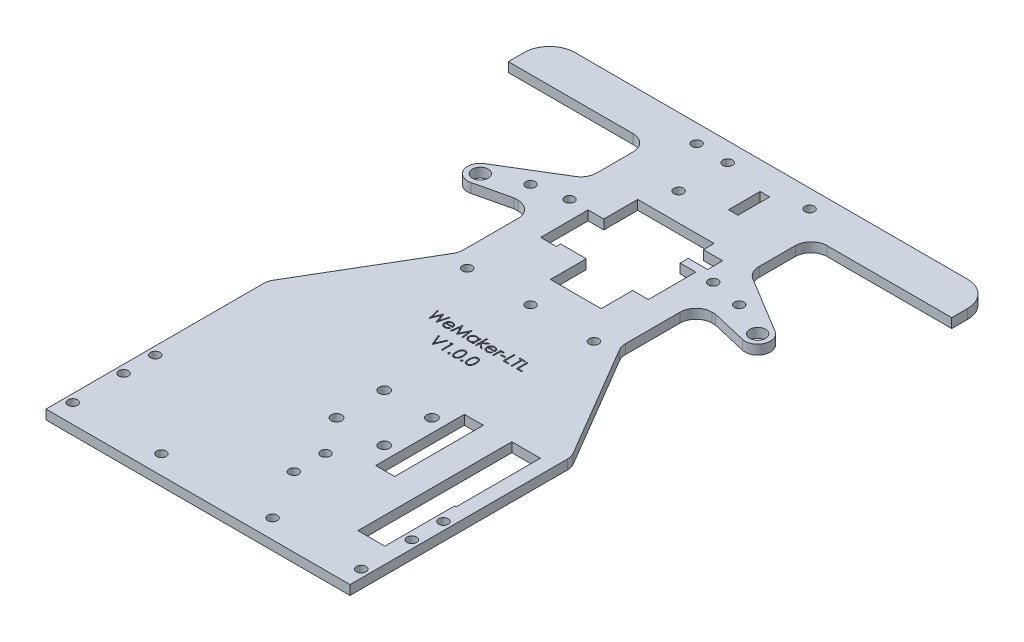
from build123d import *

# Parameters (mm, degrees)
SKETCH1_R           = 1.5
SKETCH1_R_2         = 1.65
SKETCH1_W           = 6
SKETCH1_H           = 28
BOSS_EXTRUDE1_DEPTH = 3
CUT_EXTRUDE2_REACH  = 109.373
SKETCH3_R           = 1.5
CUT_EXTRUDE3_REACH  = 109.373
SKETCH4_W           = 22.395
SKETCH4_H           = 68
SKETCH6_W           = 51.21
SKETCH6_H           = 5
BOSS_EXTRUDE2_DEPTH = 3
CUT_EXTRUDE4_REACH  = 109.373
SKETCH7_R           = 1.5
CUT_EXTRUDE5_REACH  = 109.373
SKETCH9_R           = 1.5
CUT_EXTRUDE6_REACH  = 109.373
SKETCH11_R          = 1.5
SKETCH11_R_2        = 2.5
BOSS_EXTRUDE3_DEPTH = 3
CUT_EXTRUDE7_REACH  = 109.373
CUT_EXTRUDE8_START  = -3
SKETCH13_W          = 4.95
SKETCH13_H          = 15
SKETCH13_W_2        = 6.078763038
SKETCH13_H_2        = 4.767996375
CUT_EXTRUDE8_DEPTH  = 3
BOSS_EXTRUDE4_DEPTH = 3
CUT_EXTRUDE9_REACH  = 120.849
SKETCH15_R          = 1.5
FILLET1_R           = 5
SKETCH16_W          = 1.346153846
SKETCH16_H          = 0.358974359
CUT_EXTRUDE10_DEPTH = 0.5
SKETCH17_R          = 1.5
SKETCH17_W          = 3
SKETCH17_H          = 10
CUT_EXTRUDE11_DEPTH = 119.848643382


with BuildPart() as part:
    # Sketch1 → Boss-Extrude1 (new body)
    with BuildSketch(Plane(origin=(0, 0, 0), x_dir=(1, 0, 0), z_dir=(0, 1, 0))):
        Polygon((-48, -80), (-48, 80), (48, 80), (48, -80), (48, -96), (-48, -96), align=None)
        with Locations(Location((45.5, -74, 0), (0, 0, 270))):
            Circle(SKETCH1_R, mode=Mode.SUBTRACT)
        with Locations(Location((45.5, -64, 0), (0, 0, 270))):
            Circle(SKETCH1_R, mode=Mode.SUBTRACT)
        with Locations(Location((-45.5, -64, 0), (0, 0, 270))):
            Circle(SKETCH1_R, mode=Mode.SUBTRACT)
        with Locations(Location((-45.5, -74, 0), (0, 0, 270))):
            Circle(SKETCH1_R, mode=Mode.SUBTRACT)
        with Locations(Location((8.25, -74, 0), (0, 0, 270))):
            Circle(SKETCH1_R, mode=Mode.SUBTRACT)
        with Locations(Location((8.25, -64, 0), (0, 0, 270))):
            Circle(SKETCH1_R, mode=Mode.SUBTRACT)
        with Locations(Location((0.259511597, -37.46931278, 0), (0, 0, 270))):
            Circle(SKETCH1_R_2, mode=Mode.SUBTRACT)
        with Locations(Location((15.320886036, -37.46931278, 0), (0, 0, 270))):
            Circle(SKETCH1_R_2, mode=Mode.SUBTRACT)
        with Locations(Location((15.320886036, -52.53068722, 0), (0, 0, 270))):
            Circle(SKETCH1_R_2, mode=Mode.SUBTRACT)
        with Locations(Location((0.259511597, -52.53068722, 0), (0, 0, 270))):
            Circle(SKETCH1_R_2, mode=Mode.SUBTRACT)
        with Locations(Location((17.55, -90, 0), (0, 0, 270))):
            Circle(SKETCH1_R, mode=Mode.SUBTRACT)
        with Locations(Location((45.55, -90, 0), (0, 0, 270))):
            Circle(SKETCH1_R, mode=Mode.SUBTRACT)
        with Locations(Location((-45.55, -90, 0), (0, 0, 90))):
            Circle(SKETCH1_R, mode=Mode.SUBTRACT)
        with Locations(Location((-17.55, -90, 0), (0, 0, 90))):
            Circle(SKETCH1_R, mode=Mode.SUBTRACT)
        with Locations((22.5, -45.4)):
            Rectangle(SKETCH1_W, SKETCH1_H, mode=Mode.SUBTRACT)
        Polygon((43, -80), (34.5, -80), (34.5, -31.4), (43, -31.4), (43.5, -31.4), (43.5, -58), (43, -58), align=None, mode=Mode.SUBTRACT)
    extrude(amount=BOSS_EXTRUDE1_DEPTH)

    # Sketch3 → Cut-Extrude2 (cut, up to next)
    with BuildSketch(Plane(origin=(0, 3, 0), x_dir=(1, 0, 0), z_dir=(0, 1, 0)), mode=Mode.PRIVATE) as cut_extrude2_sk1:
        with Locations(Location((0, 9, 0), (0, 0, 270))):
            Circle(SKETCH3_R)
    cut_extrude2_tool1 = extrude(cut_extrude2_sk1.sketch, amount=-CUT_EXTRUDE2_REACH, mode=Mode.PRIVATE) & part.part
    add(cut_extrude2_tool1.solids().sort_by_distance((0, 3, -9))[0], mode=Mode.SUBTRACT)

    # Sketch4 → Cut-Extrude3 (cut, up to next)
    with BuildSketch(Plane(origin=(0, 3, 0), x_dir=(1, 0, 0), z_dir=(0, 1, 0)), mode=Mode.PRIVATE) as cut_extrude3_sk1:
        with Locations((36.8025, 46)):
            Rectangle(SKETCH4_W, SKETCH4_H)
    cut_extrude3_tool1 = extrude(cut_extrude3_sk1.sketch, amount=-CUT_EXTRUDE3_REACH, mode=Mode.PRIVATE) & part.part
    # Sketch4 → Cut-Extrude3 (cut, up to next)
    with BuildSketch(Plane(origin=(0, 3, 0), x_dir=(1, 0, 0), z_dir=(0, 1, 0)), mode=Mode.PRIVATE) as cut_extrude3_sk2:
        with Locations((-36.8025, 46)):
            Rectangle(SKETCH4_W, SKETCH4_H)
    cut_extrude3_tool2 = extrude(cut_extrude3_sk2.sketch, amount=-CUT_EXTRUDE3_REACH, mode=Mode.PRIVATE) & part.part
    add(cut_extrude3_tool1.solids().sort_by_distance((36.8025, 3, -46))[0], mode=Mode.SUBTRACT)
    add(cut_extrude3_tool2.solids().sort_by_distance((-36.8025, 3, -46))[0], mode=Mode.SUBTRACT)

    # Sketch6 → Boss-Extrude2 (add)
    with BuildSketch(Plane(origin=(0, 3, 0), x_dir=(1, 0, 0), z_dir=(0, 1, 0))):
        with Locations((0, 82.5)):
            Rectangle(SKETCH6_W, SKETCH6_H)
    extrude(amount=-BOSS_EXTRUDE2_DEPTH)

    # Sketch7 → Cut-Extrude4 (cut, up to next)
    with BuildSketch(Plane(origin=(0, 3, 0), x_dir=(1, 0, 0), z_dir=(0, 1, 0)), mode=Mode.PRIVATE) as cut_extrude4_sk1:
        with Locations(Location((-17.8495, 79.268380868, 0), (0, 0, 270))):
            Circle(SKETCH7_R)
    cut_extrude4_tool1 = extrude(cut_extrude4_sk1.sketch, amount=-CUT_EXTRUDE4_REACH, mode=Mode.PRIVATE) & part.part
    # Sketch7 → Cut-Extrude4 (cut, up to next)
    with BuildSketch(Plane(origin=(0, 3, 0), x_dir=(1, 0, 0), z_dir=(0, 1, 0)), mode=Mode.PRIVATE) as cut_extrude4_sk2:
        with Locations(Location((17.8495, 79.268380868, 0), (0, 0, 270))):
            Circle(SKETCH7_R)
    cut_extrude4_tool2 = extrude(cut_extrude4_sk2.sketch, amount=-CUT_EXTRUDE4_REACH, mode=Mode.PRIVATE) & part.part
    add(cut_extrude4_tool1.solids().sort_by_distance((-17.8495, 3, -79.268381))[0], mode=Mode.SUBTRACT)
    add(cut_extrude4_tool2.solids().sort_by_distance((17.8495, 3, -79.268381))[0], mode=Mode.SUBTRACT)

    # Sketch9 → Cut-Extrude5 (cut, up to next)
    with BuildSketch(Plane(origin=(0, 3, 0), x_dir=(1, 0, 0), z_dir=(0, 1, 0)), mode=Mode.PRIVATE) as cut_extrude5_sk1:
        with Locations(Location((-22.6907969, 44, 0), (0, 0, 270))):
            Circle(SKETCH9_R)
    cut_extrude5_tool1 = extrude(cut_extrude5_sk1.sketch, amount=-CUT_EXTRUDE5_REACH, mode=Mode.PRIVATE) & part.part
    # Sketch9 → Cut-Extrude5 (cut, up to next)
    with BuildSketch(Plane(origin=(0, 3, 0), x_dir=(1, 0, 0), z_dir=(0, 1, 0)), mode=Mode.PRIVATE) as cut_extrude5_sk2:
        with Locations(Location((22.6907969, 44, 0), (0, 0, 270))):
            Circle(SKETCH9_R)
    cut_extrude5_tool2 = extrude(cut_extrude5_sk2.sketch, amount=-CUT_EXTRUDE5_REACH, mode=Mode.PRIVATE) & part.part
    add(cut_extrude5_tool1.solids().sort_by_distance((-22.690797, 3, -44))[0], mode=Mode.SUBTRACT)
    add(cut_extrude5_tool2.solids().sort_by_distance((22.690797, 3, -44))[0], mode=Mode.SUBTRACT)

    # Sketch10 → Cut-Extrude6 (cut, up to next)
    with BuildSketch(Plane(origin=(0, 3, 0), x_dir=(1, 0, 0), z_dir=(0, 1, 0)), mode=Mode.PRIVATE) as cut_extrude6_sk1:
        Polygon((48, -26), (25.605, 12), (48, 12), align=None)
    cut_extrude6_tool1 = extrude(cut_extrude6_sk1.sketch, amount=-CUT_EXTRUDE6_REACH, mode=Mode.PRIVATE) & part.part
    # Sketch10 → Cut-Extrude6 (cut, up to next)
    with BuildSketch(Plane(origin=(0, 3, 0), x_dir=(1, 0, 0), z_dir=(0, 1, 0)), mode=Mode.PRIVATE) as cut_extrude6_sk2:
        Polygon((-48, -26), (-48, 12), (-25.605, 12), align=None)
    cut_extrude6_tool2 = extrude(cut_extrude6_sk2.sketch, amount=-CUT_EXTRUDE6_REACH, mode=Mode.PRIVATE) & part.part
    add(cut_extrude6_tool1.solids().sort_by_distance((40.535, 3, 0.666667))[0], mode=Mode.SUBTRACT)
    add(cut_extrude6_tool2.solids().sort_by_distance((-40.535, 3, 0.666667))[0], mode=Mode.SUBTRACT)

    # Sketch11 → Boss-Extrude3 (add)
    # profile 1 of 2: a face of its own
    with BuildSketch(Plane.XZ):
        with BuildLine():
            Line((-45.873798612, -40.351535952), (-25.605, -52.641311078))
            Line((-25.605, -52.641311078), (-25.605, -35.641311078))
            Line((-25.605, -35.641311078), (-31.796655586, -35.641311078))
            Line((-31.796655586, -35.641311078), (-42.885371512, -33.037114659))
            ThreePointArc((-42.885371512, -33.037114659), (-47.502761912, -35.418300045), (-45.873798612, -40.351535952))
        make_face()
        with Locations(Location((-32.930328676, -41.931167665, 0), (0, 0, 270))):
            Circle(SKETCH11_R, mode=Mode.SUBTRACT)
        with Locations(Location((-43.799893893, -36.931167665, 0), (0, 0, 270))):
            Circle(SKETCH11_R_2, mode=Mode.SUBTRACT)
    # profile 2 of 2: a face of its own
    with BuildSketch(Plane.XZ):
        with BuildLine():
            Line((25.605, -35.641311078), (25.605, -52.641311078))
            Line((25.605, -52.641311078), (45.873798612, -40.351535952))
            ThreePointArc((45.873798612, -40.351535952), (47.502761912, -35.418300045), (42.885371512, -33.037114659))
            Line((42.885371512, -33.037114659), (31.796655586, -35.641311078))
            Line((31.796655586, -35.641311078), (25.605, -35.641311078))
        make_face()
        with Locations(Location((32.930328676, -41.931167665, 0), (0, 0, 270))):
            Circle(SKETCH11_R, mode=Mode.SUBTRACT)
        with Locations(Location((43.799893893, -36.931167665, 0), (0, 0, 270))):
            Circle(SKETCH11_R_2, mode=Mode.SUBTRACT)
    extrude(amount=-BOSS_EXTRUDE3_DEPTH)

    # Sketch12 → Cut-Extrude7 (cut, up to next)
    with BuildSketch(Plane.XZ, mode=Mode.PRIVATE) as cut_extrude7_sk1:
        Polygon((-11.899893893, -39.441311078), (-11.899893893, -54.741311078), (12.200106107, -54.741311078), (12.200106107, -39.441311078), (17.036431901, -39.441311078), (17.164018107, -32.041311078), (12.200106107, -32.041311078), (12.200106107, -31.191311078), (12.200106107, -25.191311078), (12.200106107, -19.091311078), (-3.799893893, -19.091311078), (-3.799893893, -30.391311078), (-11.899893893, -30.391311078), (-11.899893893, -32.041311078), (-16.849893893, -32.041311078), (-16.849893893, -39.441311078), align=None)
    cut_extrude7_tool1 = extrude(cut_extrude7_sk1.sketch, amount=-CUT_EXTRUDE7_REACH, mode=Mode.PRIVATE) & part.part
    add(cut_extrude7_tool1.solids().sort_by_distance((1.013826, 0, -38.139532))[0], mode=Mode.SUBTRACT)

    # Sketch13 → Cut-Extrude8 (cut)
    with BuildSketch(Plane.XZ.offset(CUT_EXTRUDE8_START)):
        with Locations((-14.374893893, -36.541311078)):
            Rectangle(SKETCH13_W, SKETCH13_H)
        with Locations((14.675106107, -36.541311078)):
            Rectangle(SKETCH13_W, SKETCH13_H)
        with Locations((15.239487626, -48.991959171)):
            Rectangle(SKETCH13_W_2, SKETCH13_H_2)
    extrude(amount=CUT_EXTRUDE8_DEPTH, mode=Mode.SUBTRACT)

    # Sketch14 → Boss-Extrude4 (add)
    with BuildSketch(Plane.XZ):
        with BuildLine():
            Line((-62, -85), (-25.605, -85))
            Line((-25.605, -85), (-25.605, -72))
            Line((-25.605, -72), (-70, -72))
            Line((-70, -72), (-70, -77))
            ThreePointArc((-70, -77), (-67.656854249, -82.656854249), (-62, -85))
        make_face()
        with BuildLine():
            Line((25.605, -72), (25.605, -85))
            Line((25.605, -85), (62, -85))
            ThreePointArc((62, -85), (67.656854249, -82.656854249), (70, -77))
            Line((70, -77), (70, -72))
            Line((70, -72), (25.605, -72))
        make_face()
    extrude(amount=-BOSS_EXTRUDE4_DEPTH)

    # Sketch15 → Cut-Extrude9 (cut, up to next)
    with BuildSketch(Plane(origin=(0, 3, 0), x_dir=(1, 0, 0), z_dir=(0, 1, 0)), mode=Mode.PRIVATE) as cut_extrude9_sk1:
        with Locations(Location((-20, 9, 0), (0, 0, 270))):
            Circle(SKETCH15_R)
    cut_extrude9_tool1 = extrude(cut_extrude9_sk1.sketch, amount=-CUT_EXTRUDE9_REACH, mode=Mode.PRIVATE) & part.part
    # Sketch15 → Cut-Extrude9 (cut, up to next)
    with BuildSketch(Plane(origin=(0, 3, 0), x_dir=(1, 0, 0), z_dir=(0, 1, 0)), mode=Mode.PRIVATE) as cut_extrude9_sk2:
        with Locations(Location((20, 9, 0), (0, 0, 270))):
            Circle(SKETCH15_R)
    cut_extrude9_tool2 = extrude(cut_extrude9_sk2.sketch, amount=-CUT_EXTRUDE9_REACH, mode=Mode.PRIVATE) & part.part
    add(cut_extrude9_tool1.solids().sort_by_distance((-20, 3, -9))[0], mode=Mode.SUBTRACT)
    add(cut_extrude9_tool2.solids().sort_by_distance((20, 3, -9))[0], mode=Mode.SUBTRACT)

    # Fillet1
    fillet1_edges = [part.edges().sort_by_distance(p)[0] for p in [
        (-25.605, 1.5, -12),
        (25.605, 1.5, -12),
        (48, 1.5, 26),
        (-48, 1.5, 26),
        (-25.605, 1.5, -35.641311078),
        (-25.605, 1.5, -52.641311078),
        (25.605, 1.5, -52.641311078),
        (25.605, 1.5, -35.641311078),
        (-25.605, 1.5, -72),
        (25.605, 1.5, -72),
    ]]
    fillet(fillet1_edges, radius=FILLET1_R)

    # Sketch16 → Cut-Extrude10 (cut)
    # profile 1 of 17: a face of its own
    with BuildSketch(Plane(origin=(0, 3, 0), x_dir=(1, 0, 0), z_dir=(0, 1, 0))):
        Polygon((-13.235751468, -7.219057058), (-12.911833199, -7.219057058), (-12.226136084, -9.787967314), (-11.208107237, -7.219057058), (-11.162534321, -7.219057058), (-10.16203352, -9.768335904), (-9.473531917, -7.219057058), (-9.152418135, -7.219057058), (-10.096128071, -10.719057058), (-10.140999866, -10.719057058), (-11.194084802, -8.043576289), (-12.258387686, -10.719057058), (-12.303960603, -10.719057058), align=None)
    # profile 2 of 17: a face of its own
    with BuildSketch(Plane(origin=(0, 3, 0), x_dir=(1, 0, 0), z_dir=(0, 1, 0))):
        with BuildLine():
            Line((-6.514797943, -9.91136475), (-6.235751468, -10.057899206))
            add(Edge.make_bspline(
                [(-6.235751468, -10.057899206), (-6.257988063, -10.097342537), (-6.301251672, -10.17408364), (-6.37565242, -10.2795155), (-6.453644492, -10.374363216), (-6.53874846, -10.45609287), (-6.628418139, -10.527344255), (-6.723150794, -10.58968208), (-6.823439612, -10.6428006), (-6.929289337, -10.687553128), (-7.041588888, -10.721962622), (-7.160610404, -10.746266843), (-7.2865819, -10.761290112), (-7.372928079, -10.763035253), (-7.417141693, -10.763928853)],
                knots=[0, 0, 0, 0, 1.120438281, 2.179929193, 3.190490725, 4.156257408, 5.095198341, 6.022838206, 6.959905092, 7.901321166, 8.864066838, 9.862729781, 10.905609505, 12, 12, 12, 12], degree=3))
            add(Edge.make_bspline(
                [(-7.417141693, -10.763928853), (-7.46628367, -10.762781678), (-7.562145432, -10.760543871), (-7.701685179, -10.741251406), (-7.833064597, -10.709779048), (-7.956276301, -10.665813506), (-8.071018553, -10.608386182), (-8.177519408, -10.5384267), (-8.276338934, -10.456294446), (-8.364363143, -10.361278002), (-8.443607026, -10.259596045), (-8.513532846, -10.15364016), (-8.571990277, -10.043676936), (-8.619542887, -9.930406412), (-8.657947752, -9.814542518), (-8.684714456, -9.695031051), (-8.700144204, -9.572195467), (-8.702508649, -9.489098131), (-8.703700186, -9.447222122)],
                knots=[0, 0, 0, 0, 1.145258523, 2.234067595, 3.276747158, 4.290159414, 5.277019952, 6.260822364, 7.254936242, 8.264827045, 9.274100331, 10.257902744, 11.220704747, 12.172965371, 13.118907548, 14.062713208, 15.023725156, 16, 16, 16, 16], degree=3))
            add(Edge.make_bspline(
                [(-8.703700186, -9.447222122), (-8.702641045, -9.407927292), (-8.700541967, -9.330050127), (-8.687311179, -9.214784583), (-8.663862886, -9.10275613), (-8.631686562, -8.993871682), (-8.590135316, -8.888313548), (-8.539303097, -8.786017484), (-8.479110719, -8.687092345), (-8.432638045, -8.624689211), (-8.409229032, -8.593255776)],
                knots=[0, 0, 0, 0, 1.024358464, 2.0301432, 3.019427413, 4.004406732, 4.986367066, 5.972626655, 6.978780325, 8, 8, 8, 8], degree=3))
            add(Edge.make_bspline(
                [(-8.409229032, -8.593255776), (-8.37752135, -8.555386906), (-8.315110403, -8.480848755), (-8.209554048, -8.38291043), (-8.095253851, -8.300866655), (-7.973642225, -8.232859518), (-7.843305751, -8.181185871), (-7.70599646, -8.142678289), (-7.560150874, -8.121100278), (-7.460445653, -8.118052445), (-7.409429353, -8.116492956)],
                knots=[0, 0, 0, 0, 1.030682036, 2.02871468, 2.997146059, 3.962720338, 4.930598197, 5.918074684, 6.934738563, 8, 8, 8, 8], degree=3))
            add(Edge.make_bspline(
                [(-7.409429353, -8.116492956), (-7.356981748, -8.117847004), (-7.254091502, -8.12050334), (-7.104059381, -8.145129673), (-6.962098664, -8.184182228), (-6.82826616, -8.239336018), (-6.702548299, -8.31049557), (-6.585762249, -8.398637411), (-6.475910737, -8.501055499), (-6.412002158, -8.579818708), (-6.379481436, -8.619898404)],
                knots=[0, 0, 0, 0, 1.056321875, 2.072262726, 3.055038591, 4.01806755, 4.982017516, 5.957941055, 6.960871419, 8, 8, 8, 8], degree=3))
            add(Edge.make_bspline(
                [(-6.379481436, -8.619898404), (-6.357354498, -8.650101986), (-6.313247905, -8.710308104), (-6.258000805, -8.808479261), (-6.21004341, -8.911189856), (-6.171710449, -9.020100153), (-6.140670948, -9.133919733), (-6.118214129, -9.253462278), (-6.10504451, -9.378692189), (-6.102455813, -9.464018745), (-6.101136084, -9.507518597)],
                knots=[0, 0, 0, 0, 0.94817472, 1.890038105, 2.849395472, 3.817997239, 4.812318967, 5.836947057, 6.897266129, 8, 8, 8, 8], degree=3))
            Line((-6.101136084, -9.507518597), (-8.389597622, -9.507518597))
            add(Edge.make_bspline(
                [(-8.389597622, -9.507518597), (-8.388058016, -9.541219061), (-8.385030442, -9.607489665), (-8.370915299, -9.704460448), (-8.348666525, -9.79683379), (-8.317397462, -9.883916832), (-8.279530617, -9.966846959), (-8.2331449, -10.045008996), (-8.177805346, -10.118046926), (-8.116079647, -10.186614064), (-8.047372551, -10.247674825), (-7.975089804, -10.302326601), (-7.898196239, -10.348132198), (-7.817298156, -10.385312088), (-7.732526371, -10.414418404), (-7.643854175, -10.434286225), (-7.551456059, -10.447593331), (-7.488470325, -10.449072997), (-7.456404513, -10.449826289)],
                knots=[0, 0, 0, 0, 1.094153842, 2.151609401, 3.174256925, 4.172055639, 5.149267565, 6.128595816, 7.11444997, 8.118368179, 9.117203808, 10.09244225, 11.054858984, 12.015122123, 12.976791628, 13.957293641, 14.960065497, 16, 16, 16, 16], degree=3))
            add(Edge.make_bspline(
                [(-7.456404513, -10.449826289), (-7.425053366, -10.449218232), (-7.362846675, -10.448011731), (-7.270205817, -10.43627982), (-7.17906629, -10.417309545), (-7.089805307, -10.391419555), (-7.004234461, -10.359842702), (-6.924988911, -10.321739845), (-6.852108695, -10.279590098), (-6.783991728, -10.231380423), (-6.717920735, -10.172372236), (-6.652378249, -10.098736515), (-6.582101595, -10.011648987), (-6.538112003, -9.946103321), (-6.514797943, -9.91136475)],
                knots=[0, 0, 0, 0, 0.99110716, 1.966546729, 2.947904876, 3.932708344, 4.903319531, 5.828989031, 6.710028674, 7.56322171, 8.463672341, 9.504779593, 10.677557249, 12, 12, 12, 12], degree=3))
        make_face()
        with BuildLine():
            add(Edge.make_bspline(
                [(-6.415238648, -9.193416032), (-6.426735272, -9.151753159), (-6.448862574, -9.071565538), (-6.495098938, -8.960524648), (-6.547170479, -8.861836747), (-6.60879221, -8.776257114), (-6.678610936, -8.700253601), (-6.759256119, -8.633835015), (-6.849692012, -8.574417564), (-6.949451153, -8.524265065), (-7.055092938, -8.481575206), (-7.16569913, -8.45295009), (-7.278556918, -8.433340548), (-7.354891204, -8.43151444), (-7.393303552, -8.43059552)],
                knots=[0, 0, 0, 0, 1.154881502, 2.222775134, 3.210006277, 4.132804581, 5.035138423, 5.962687519, 6.919655026, 7.923214229, 8.944639381, 9.960483929, 10.97369054, 12, 12, 12, 12], degree=3))
            add(Edge.make_bspline(
                [(-7.393303552, -8.43059552), (-7.42465299, -8.431207191), (-7.486624239, -8.432416337), (-7.577925307, -8.443886467), (-7.665605006, -8.462846311), (-7.750310294, -8.488811268), (-7.830931162, -8.523419871), (-7.90912593, -8.564003097), (-7.982906327, -8.613544681), (-8.029047622, -8.651303536), (-8.052358039, -8.670379173)],
                knots=[0, 0, 0, 0, 1.04873581, 2.073130211, 3.073294108, 4.04793562, 5.032784715, 6.005352987, 6.992311501, 8, 8, 8, 8], degree=3))
            add(Edge.make_bspline(
                [(-8.052358039, -8.670379173), (-8.069051321, -8.685473489), (-8.102834455, -8.716020705), (-8.147974976, -8.768649912), (-8.191195449, -8.825401474), (-8.230529102, -8.888446598), (-8.266606688, -8.957067377), (-8.300366666, -9.030685013), (-8.330753078, -9.109858143), (-8.347849188, -9.165030582), (-8.356644898, -9.193416032)],
                knots=[0, 0, 0, 0, 0.879870761, 1.780643979, 2.707998968, 3.669668524, 4.684282772, 5.740141944, 6.837334558, 8, 8, 8, 8], degree=3))
            Line((-8.356644898, -9.193416032), (-6.415238648, -9.193416032))
        make_face(mode=Mode.SUBTRACT)
    # profile 3 of 17: a face of its own
    with BuildSketch(Plane(origin=(0, 3, 0), x_dir=(1, 0, 0), z_dir=(0, 1, 0))):
        Polygon((-5.562674545, -10.719057058), (-5.100635282, -7.219057058), (-5.055763487, -7.219057058), (-3.610751468, -10.09085193), (-2.16994618, -7.219057058), (-2.125074385, -7.219057058), (-1.658828391, -10.719057058), (-1.972930955, -10.719057058), (-2.309469417, -8.202730936), (-3.57218977, -10.719057058), (-3.643704193, -10.719057058), (-4.91203352, -8.195018597), (-5.246468616, -10.719057058), align=None)
    # profile 4 of 17: a face of its own
    with BuildSketch(Plane(origin=(0, 3, 0), x_dir=(1, 0, 0), z_dir=(0, 1, 0))):
        with BuildLine():
            Line((1.571940839, -8.16136475), (1.571940839, -10.719057058))
            Line((1.571940839, -10.719057058), (1.257838275, -10.719057058))
            Line((1.257838275, -10.719057058), (1.257838275, -10.276649206))
            add(Edge.make_bspline(
                [(1.257838275, -10.276649206), (1.222419485, -10.316688799), (1.153299269, -10.394826571), (1.037858151, -10.496908743), (0.915489974, -10.581287065), (0.786788652, -10.64943698), (0.651870409, -10.700629037), (0.511034322, -10.737015196), (0.364222941, -10.760409031), (0.263970586, -10.762745053), (0.213166801, -10.763928853)],
                knots=[0, 0, 0, 0, 1.074387032, 2.096679803, 3.090159297, 4.057316773, 5.018401886, 5.985159533, 6.978961417, 8, 8, 8, 8], degree=3))
            add(Edge.make_bspline(
                [(0.213166801, -10.763928853), (0.167998847, -10.762702481), (0.078925642, -10.76028402), (-0.052103435, -10.741521717), (-0.178195684, -10.711391095), (-0.299470257, -10.669490206), (-0.415142402, -10.613909384), (-0.526202499, -10.547368136), (-0.632075191, -10.468127306), (-0.73114673, -10.377539277), (-0.82237873, -10.27914429), (-0.902440003, -10.174198743), (-0.969193083, -10.063156439), (-1.025013164, -9.947423286), (-1.068009508, -9.826108366), (-1.097983142, -9.699631198), (-1.116723589, -9.568141325), (-1.11914105, -9.478601801), (-1.120366853, -9.433199686)],
                knots=[0, 0, 0, 0, 1.033919861, 2.038935746, 3.024066025, 3.998881131, 4.97069526, 5.957263378, 6.95902576, 7.993208707, 9.027059324, 10.027763471, 11.009749337, 11.988697705, 12.965288445, 13.950418724, 14.960734635, 16, 16, 16, 16], degree=3))
            add(Edge.make_bspline(
                [(-1.120366853, -9.433199686), (-1.119113881, -9.388735983), (-1.116636825, -9.300833639), (-1.098183605, -9.171554941), (-1.067152596, -9.047036681), (-1.023604748, -8.927679737), (-0.967762794, -8.813339687), (-0.899834706, -8.703935662), (-0.819815582, -8.599166265), (-0.727563175, -8.501495038), (-0.627628405, -8.411274424), (-0.520719674, -8.332865378), (-0.409496392, -8.265148529), (-0.292233382, -8.211495053), (-0.170666277, -8.168085949), (-0.043712831, -8.138052981), (0.088098747, -8.120355659), (0.177589239, -8.117792895), (0.222982506, -8.116492956)],
                knots=[0, 0, 0, 0, 1.020392517, 2.01726096, 2.990465484, 3.961182959, 4.928053699, 5.906110375, 6.912531644, 7.948652711, 8.985773172, 9.998621852, 10.987621588, 11.969261332, 12.953316658, 13.946091881, 14.958173133, 16, 16, 16, 16], degree=3))
            add(Edge.make_bspline(
                [(0.222982506, -8.116492956), (0.275182365, -8.117930707), (0.377543825, -8.12075007), (0.527271834, -8.144212797), (0.668916312, -8.183851264), (0.803570664, -8.237768762), (0.93075135, -8.309417492), (1.049254335, -8.399797453), (1.160319818, -8.50833864), (1.22470011, -8.591709084), (1.257838275, -8.634621962)],
                knots=[0, 0, 0, 0, 1.038897134, 2.037228247, 3.008116434, 3.962042015, 4.918381754, 5.904844433, 6.921570401, 8, 8, 8, 8], degree=3))
            Line((1.257838275, -8.634621962), (1.257838275, -8.16136475))
            Line((1.257838275, -8.16136475), (1.571940839, -8.16136475))
        make_face()
        with BuildLine():
            add(Edge.make_bspline(
                [(0.227189237, -8.43059552), (0.181274899, -8.432229157), (0.090647299, -8.435453698), (-0.042396703, -8.460627194), (-0.169710117, -8.502511788), (-0.290656191, -8.559793689), (-0.403324408, -8.631822426), (-0.504018079, -8.718943809), (-0.59356078, -8.818780823), (-0.668869044, -8.930882934), (-0.730259541, -9.051061025), (-0.773426573, -9.176685463), (-0.801895821, -9.30549044), (-0.804804341, -9.392853126), (-0.806264289, -9.436705295)],
                knots=[0, 0, 0, 0, 1.031046209, 2.035121221, 3.029706178, 4.034933723, 5.034054252, 6.02443088, 7.017295772, 8.038157696, 9.050218397, 10.03989886, 11.016116709, 12, 12, 12, 12], degree=3))
            add(Edge.make_bspline(
                [(-0.806264289, -9.436705295), (-0.804399395, -9.480295402), (-0.800676919, -9.567304758), (-0.773926224, -9.696285335), (-0.729046351, -9.821939377), (-0.667804288, -9.943200371), (-0.591117663, -10.055784471), (-0.502229011, -10.157524594), (-0.400278729, -10.245014182), (-0.287351222, -10.318251755), (-0.166743252, -10.377414276), (-0.03990932, -10.418579916), (0.090766318, -10.445157696), (0.179618652, -10.448262173), (0.22438475, -10.449826289)],
                knots=[0, 0, 0, 0, 0.979072187, 1.954306742, 2.945804271, 3.96968567, 4.997920485, 5.998718438, 6.996577872, 8.005894225, 9.015743152, 10.005417472, 10.995077863, 12, 12, 12, 12], degree=3))
            add(Edge.make_bspline(
                [(0.22438475, -10.449826289), (0.269831252, -10.448166325), (0.360219839, -10.444864821), (0.493658547, -10.419583556), (0.62315351, -10.377814758), (0.746940738, -10.319915631), (0.862256869, -10.248158275), (0.965754747, -10.164151184), (1.053270715, -10.066448), (1.127463325, -9.959071547), (1.185638741, -9.84135955), (1.228014801, -9.71602536), (1.253068706, -9.583064611), (1.256226436, -9.492200685), (1.257838275, -9.445819879)],
                knots=[0, 0, 0, 0, 1.01762866, 2.023962475, 3.030623092, 4.058876274, 5.077231937, 6.066672613, 7.034107872, 8.005628644, 8.981990164, 9.965428785, 10.961468474, 12, 12, 12, 12], degree=3))
            add(Edge.make_bspline(
                [(1.257838275, -9.445819879), (1.256878619, -9.410482048), (1.254989712, -9.340926015), (1.240559142, -9.238798497), (1.217604216, -9.141064771), (1.185258046, -9.047622082), (1.142766761, -8.958987067), (1.091518995, -8.874523306), (1.030613546, -8.794670095), (0.961030849, -8.720527024), (0.884865647, -8.652900562), (0.804271106, -8.592536321), (0.718292359, -8.542947548), (0.628375322, -8.501906277), (0.534363988, -8.469247127), (0.435493368, -8.447459433), (0.332814381, -8.432499112), (0.262768326, -8.431236731), (0.227189237, -8.43059552)],
                knots=[0, 0, 0, 0, 1.050140795, 2.067009409, 3.05949893, 4.030605086, 5.00011959, 5.97591094, 6.962425594, 7.979863591, 8.993523472, 9.986985069, 10.967611495, 11.937549037, 12.921786183, 13.919465291, 14.943216303, 16, 16, 16, 16], degree=3))
        make_face(mode=Mode.SUBTRACT)
    # profile 5 of 17: a face of its own
    with BuildSketch(Plane(origin=(0, 3, 0), x_dir=(1, 0, 0), z_dir=(0, 1, 0))):
        Polygon((2.289889557, -7.129313468), (2.603992122, -7.129313468), (2.603992122, -9.204633981), (3.768555423, -8.16136475), (4.219376737, -8.16136475), (2.86901616, -9.372903212), (4.353992122, -10.719057058), (3.903170807, -10.719057058), (2.603992122, -9.540471321), (2.603992122, -10.719057058), (2.289889557, -10.719057058), align=None)
    # profile 6 of 17: a face of its own
    with BuildSketch(Plane(origin=(0, 3, 0), x_dir=(1, 0, 0), z_dir=(0, 1, 0))):
        with BuildLine():
            Line((6.812125134, -9.91136475), (7.091171609, -10.057899206))
            add(Edge.make_bspline(
                [(7.091171609, -10.057899206), (7.068935013, -10.097342537), (7.025671405, -10.17408364), (6.951270657, -10.2795155), (6.873278584, -10.374363216), (6.788174616, -10.45609287), (6.698504938, -10.527344255), (6.603772283, -10.58968208), (6.503483465, -10.6428006), (6.39763374, -10.687553128), (6.285334189, -10.721962622), (6.166312673, -10.746266843), (6.040341177, -10.761290112), (5.953994997, -10.763035253), (5.909781384, -10.763928853)],
                knots=[0, 0, 0, 0, 1.120438281, 2.179929193, 3.190490725, 4.156257408, 5.095198341, 6.022838206, 6.959905092, 7.901321166, 8.864066838, 9.862729781, 10.905609505, 12, 12, 12, 12], degree=3))
            add(Edge.make_bspline(
                [(5.909781384, -10.763928853), (5.860639407, -10.762781678), (5.764777645, -10.760543871), (5.625237898, -10.741251406), (5.49385848, -10.709779048), (5.370646776, -10.665813506), (5.255904524, -10.608386182), (5.149403669, -10.5384267), (5.050584143, -10.456294446), (4.962559934, -10.361278002), (4.883316051, -10.259596045), (4.813390231, -10.15364016), (4.7549328, -10.043676936), (4.70738019, -9.930406412), (4.668975325, -9.814542518), (4.642208621, -9.695031051), (4.626778873, -9.572195467), (4.624414428, -9.489098131), (4.623222891, -9.447222122)],
                knots=[0, 0, 0, 0, 1.145258523, 2.234067595, 3.276747158, 4.290159414, 5.277019952, 6.260822364, 7.254936242, 8.264827045, 9.274100331, 10.257902744, 11.220704747, 12.172965371, 13.118907548, 14.062713208, 15.023725156, 16, 16, 16, 16], degree=3))
            add(Edge.make_bspline(
                [(4.623222891, -9.447222122), (4.624282032, -9.407927292), (4.62638111, -9.330050127), (4.639611898, -9.214784583), (4.663060191, -9.10275613), (4.695236515, -8.993871682), (4.736787761, -8.888313548), (4.78761998, -8.786017484), (4.847812358, -8.687092345), (4.894285032, -8.624689211), (4.917694045, -8.593255776)],
                knots=[0, 0, 0, 0, 1.024358464, 2.0301432, 3.019427413, 4.004406732, 4.986367066, 5.972626655, 6.978780325, 8, 8, 8, 8], degree=3))
            add(Edge.make_bspline(
                [(4.917694045, -8.593255776), (4.949401727, -8.555386906), (5.011812674, -8.480848755), (5.117369029, -8.38291043), (5.231669226, -8.300866655), (5.353280852, -8.232859518), (5.483617326, -8.181185871), (5.620926617, -8.142678289), (5.766772203, -8.121100278), (5.866477424, -8.118052445), (5.917493724, -8.116492956)],
                knots=[0, 0, 0, 0, 1.030682036, 2.02871468, 2.997146059, 3.962720338, 4.930598197, 5.918074684, 6.934738563, 8, 8, 8, 8], degree=3))
            add(Edge.make_bspline(
                [(5.917493724, -8.116492956), (5.969941329, -8.117847004), (6.072831575, -8.12050334), (6.222863696, -8.145129673), (6.364824413, -8.184182228), (6.498656917, -8.239336018), (6.624374778, -8.31049557), (6.741160828, -8.398637411), (6.85101234, -8.501055499), (6.914920919, -8.579818708), (6.947441641, -8.619898404)],
                knots=[0, 0, 0, 0, 1.056321875, 2.072262726, 3.055038591, 4.01806755, 4.982017516, 5.957941055, 6.960871419, 8, 8, 8, 8], degree=3))
            add(Edge.make_bspline(
                [(6.947441641, -8.619898404), (6.969568579, -8.650101986), (7.013675172, -8.710308104), (7.068922272, -8.808479261), (7.116879667, -8.911189856), (7.155212628, -9.020100153), (7.186252129, -9.133919733), (7.208708948, -9.253462278), (7.221878567, -9.378692189), (7.224467264, -9.464018745), (7.225786993, -9.507518597)],
                knots=[0, 0, 0, 0, 0.94817472, 1.890038105, 2.849395472, 3.817997239, 4.812318967, 5.836947057, 6.897266129, 8, 8, 8, 8], degree=3))
            Line((7.225786993, -9.507518597), (4.937325455, -9.507518597))
            add(Edge.make_bspline(
                [(4.937325455, -9.507518597), (4.938865061, -9.541219061), (4.941892635, -9.607489665), (4.956007778, -9.704460448), (4.978256552, -9.79683379), (5.009525615, -9.883916832), (5.04739246, -9.966846959), (5.093778177, -10.045008996), (5.149117731, -10.118046926), (5.21084343, -10.186614064), (5.279550526, -10.247674825), (5.351833273, -10.302326601), (5.428726838, -10.348132198), (5.509624921, -10.385312088), (5.594396706, -10.414418404), (5.683068901, -10.434286225), (5.775467018, -10.447593331), (5.838452752, -10.449072997), (5.870518564, -10.449826289)],
                knots=[0, 0, 0, 0, 1.094153842, 2.151609401, 3.174256925, 4.172055639, 5.149267565, 6.128595816, 7.11444997, 8.118368179, 9.117203808, 10.09244225, 11.054858984, 12.015122123, 12.976791628, 13.957293641, 14.960065497, 16, 16, 16, 16], degree=3))
            add(Edge.make_bspline(
                [(5.870518564, -10.449826289), (5.901869711, -10.449218232), (5.964076402, -10.448011731), (6.05671726, -10.43627982), (6.147856787, -10.417309545), (6.23711777, -10.391419555), (6.322688616, -10.359842702), (6.401934166, -10.321739845), (6.474814382, -10.279590098), (6.542931349, -10.231380423), (6.609002342, -10.172372236), (6.674544828, -10.098736515), (6.744821482, -10.011648987), (6.788811074, -9.946103321), (6.812125134, -9.91136475)],
                knots=[0, 0, 0, 0, 0.99110716, 1.966546729, 2.947904876, 3.932708344, 4.903319531, 5.828989031, 6.710028674, 7.56322171, 8.463672341, 9.504779593, 10.677557249, 12, 12, 12, 12], degree=3))
        make_face()
        with BuildLine():
            add(Edge.make_bspline(
                [(6.911684429, -9.193416032), (6.900187805, -9.151753159), (6.878060503, -9.071565538), (6.831824139, -8.960524648), (6.779752598, -8.861836747), (6.718130867, -8.776257114), (6.648312141, -8.700253601), (6.567666958, -8.633835015), (6.477231065, -8.574417564), (6.377471924, -8.524265065), (6.271830139, -8.481575206), (6.161223947, -8.45295009), (6.048366159, -8.433340548), (5.972031873, -8.43151444), (5.933619525, -8.43059552)],
                knots=[0, 0, 0, 0, 1.154881502, 2.222775134, 3.210006277, 4.132804581, 5.035138423, 5.962687519, 6.919655026, 7.923214229, 8.944639381, 9.960483929, 10.97369054, 12, 12, 12, 12], degree=3))
            add(Edge.make_bspline(
                [(5.933619525, -8.43059552), (5.902270087, -8.431207191), (5.840298838, -8.432416337), (5.74899777, -8.443886467), (5.661318071, -8.462846311), (5.576612783, -8.488811268), (5.495991915, -8.523419871), (5.417797146, -8.564003097), (5.34401675, -8.613544681), (5.297875455, -8.651303536), (5.274565038, -8.670379173)],
                knots=[0, 0, 0, 0, 1.04873581, 2.073130211, 3.073294108, 4.04793562, 5.032784715, 6.005352987, 6.992311501, 8, 8, 8, 8], degree=3))
            add(Edge.make_bspline(
                [(5.274565038, -8.670379173), (5.257871756, -8.685473489), (5.224088622, -8.716020705), (5.1789481, -8.768649912), (5.135727628, -8.825401474), (5.096393975, -8.888446598), (5.060316389, -8.957067377), (5.026556411, -9.030685013), (4.996169999, -9.109858143), (4.979073889, -9.165030582), (4.970278179, -9.193416032)],
                knots=[0, 0, 0, 0, 0.879870761, 1.780643979, 2.707998968, 3.669668524, 4.684282772, 5.740141944, 6.837334558, 8, 8, 8, 8], degree=3))
            Line((4.970278179, -9.193416032), (6.911684429, -9.193416032))
        make_face(mode=Mode.SUBTRACT)
    # profile 7 of 17: a face of its own
    with BuildSketch(Plane(origin=(0, 3, 0), x_dir=(1, 0, 0), z_dir=(0, 1, 0))):
        with BuildLine():
            Line((7.764248532, -8.16136475), (8.078351096, -8.16136475))
            Line((8.078351096, -8.16136475), (8.078351096, -8.537867154))
            add(Edge.make_bspline(
                [(8.078351096, -8.537867154), (8.101539855, -8.502811326), (8.145888176, -8.435767327), (8.219601105, -8.347098026), (8.295104436, -8.273682979), (8.372759623, -8.21517946), (8.453137723, -8.171366341), (8.534474675, -8.139273306), (8.618050145, -8.120295991), (8.674212069, -8.117762332), (8.702349493, -8.116492956)],
                knots=[0, 0, 0, 0, 1.2804753, 2.448899062, 3.506932113, 4.484331642, 5.4025378, 6.288909075, 7.142734305, 8, 8, 8, 8], degree=3))
            add(Edge.make_bspline(
                [(8.702349493, -8.116492956), (8.72417582, -8.117683482), (8.769084905, -8.120133068), (8.837067495, -8.137343893), (8.907110947, -8.164821915), (8.952253334, -8.190662138), (8.975786993, -8.20413318)],
                knots=[0, 0, 0, 0, 0.901110191, 1.854092781, 2.881294221, 4, 4, 4, 4], degree=3))
            Line((8.975786993, -8.20413318), (8.803311032, -8.476168436))
            add(Edge.make_bspline(
                [(8.803311032, -8.476168436), (8.788202011, -8.46942817), (8.759522196, -8.456633855), (8.71756763, -8.441491845), (8.678886293, -8.432575929), (8.654242735, -8.431225211), (8.642754141, -8.43059552)],
                knots=[0, 0, 0, 0, 1.180555205, 2.24091978, 3.179933427, 4, 4, 4, 4], degree=3))
            add(Edge.make_bspline(
                [(8.642754141, -8.43059552), (8.617548407, -8.432275557), (8.566136017, -8.435702346), (8.490651518, -8.462641154), (8.417404312, -8.506166394), (8.35923265, -8.554437506), (8.314190397, -8.600985303), (8.282050172, -8.641633706), (8.252567425, -8.687212338), (8.224397204, -8.736942021), (8.19873091, -8.791671867), (8.174776241, -8.850855081), (8.153117378, -8.91456021), (8.140767134, -8.95894273), (8.134440839, -8.98167725)],
                knots=[0, 0, 0, 0, 1.125678352, 2.296057538, 3.5422874, 4.923748041, 5.663163013, 6.437101912, 7.23742474, 8.08941207, 8.991984279, 9.93940061, 10.944477711, 12, 12, 12, 12], degree=3))
            add(Edge.make_bspline(
                [(8.134440839, -8.98167725), (8.129708446, -9.001954424), (8.119226554, -9.046866823), (8.109035017, -9.122215347), (8.098965499, -9.211239006), (8.09186888, -9.314185599), (8.085290838, -9.430798043), (8.081580756, -9.561253989), (8.078477615, -9.70568734), (8.078394548, -9.806661693), (8.078351096, -9.859481738)],
                knots=[0, 0, 0, 0, 0.566838948, 1.255505196, 2.06880316, 3.007127437, 4.065329342, 5.249902469, 6.561414163, 8, 8, 8, 8], degree=3))
            Line((8.078351096, -9.859481738), (8.078351096, -10.719057058))
            Line((8.078351096, -10.719057058), (7.764248532, -10.719057058))
            Line((7.764248532, -10.719057058), (7.764248532, -8.16136475))
        make_face()
    # profile 8 of 17: a face of its own
    with BuildSketch(Plane(origin=(0, 3, 0), x_dir=(1, 0, 0), z_dir=(0, 1, 0))):
        with Locations((9.738607506, -9.372903212)):
            Rectangle(SKETCH16_W, SKETCH16_H)
    # profile 9 of 17: a face of its own
    with BuildSketch(Plane(origin=(0, 3, 0), x_dir=(1, 0, 0), z_dir=(0, 1, 0))):
        Polygon((10.995017763, -7.219057058), (11.309120327, -7.219057058), (11.309120327, -10.360082699), (12.655274173, -10.360082699), (12.655274173, -10.719057058), (10.995017763, -10.719057058), align=None)
    # profile 10 of 17: a face of its own
    with BuildSketch(Plane(origin=(0, 3, 0), x_dir=(1, 0, 0), z_dir=(0, 1, 0))):
        Polygon((12.834761352, -7.578031417), (12.834761352, -7.219057058), (14.674504942, -7.219057058), (14.674504942, -7.578031417), (13.911684429, -7.578031417), (13.911684429, -10.719057058), (13.597581865, -10.719057058), (13.597581865, -7.578031417), align=None)
    # profile 11 of 17: a face of its own
    with BuildSketch(Plane(origin=(0, 3, 0), x_dir=(1, 0, 0), z_dir=(0, 1, 0))):
        Polygon((15.21296648, -7.219057058), (15.527069045, -7.219057058), (15.527069045, -10.360082699), (16.873222891, -10.360082699), (16.873222891, -10.719057058), (15.21296648, -10.719057058), align=None)
    # profile 12 of 17: a face of its own
    with BuildSketch(Plane(origin=(0, 3, 0), x_dir=(1, 0, 0), z_dir=(0, 1, 0))):
        Polygon((-6.202786723, -13.88459244), (-5.866248262, -13.88459244), (-4.700282717, -16.640702216), (-3.53361605, -13.88459244), (-3.196376467, -13.88459244), (-4.677145698, -17.38459244), (-4.722017492, -17.38459244), align=None)
    # profile 13 of 17: a face of its own
    with BuildSketch(Plane(origin=(0, 3, 0), x_dir=(1, 0, 0), z_dir=(0, 1, 0))):
        Polygon((-2.138383678, -13.88459244), (-1.491248262, -13.88459244), (-1.491248262, -17.38459244), (-1.805350826, -17.38459244), (-1.805350826, -14.243566799), (-2.343812364, -14.243566799), align=None)
    # profile 14 of 17: a face of its own
    with BuildSketch(Plane(origin=(0, 3, 0), x_dir=(1, 0, 0), z_dir=(0, 1, 0))):
        with BuildLine():
            add(Edge.make_bspline(
                [(0.370931226, -16.846130902), (0.390421438, -16.847289069), (0.42862972, -16.849559519), (0.483868848, -16.865136193), (0.533863508, -16.892794853), (0.578395753, -16.929657632), (0.615102229, -16.974353295), (0.643746582, -17.023949203), (0.659187567, -17.079650796), (0.661441479, -17.118080471), (0.662597892, -17.137797569)],
                knots=[0, 0, 0, 0, 1.020151414, 1.999887582, 2.974338812, 3.990962822, 5.007586832, 5.987933904, 6.967670073, 8, 8, 8, 8], degree=3))
            add(Edge.make_bspline(
                [(0.662597892, -17.137797569), (0.661402291, -17.157040898), (0.659044584, -17.194988462), (0.643781976, -17.250269925), (0.614883926, -17.299896829), (0.578648933, -17.345198967), (0.533852499, -17.382139838), (0.483750653, -17.409563183), (0.428759395, -17.426255162), (0.390443072, -17.42838146), (0.370931226, -17.429464235)],
                knots=[0, 0, 0, 0, 1.009421747, 1.99056486, 2.972319754, 3.999869655, 5.017953583, 5.993804169, 6.978383603, 8, 8, 8, 8], degree=3))
            add(Edge.make_bspline(
                [(0.370931226, -17.429464235), (0.35140532, -17.428420638), (0.313285637, -17.426383263), (0.258499643, -17.409220457), (0.208092674, -17.382396996), (0.163304963, -17.345130087), (0.126766491, -17.300129944), (0.099141108, -17.249928147), (0.082550959, -17.19514671), (0.080369087, -17.157072067), (0.079264559, -17.137797569)],
                knots=[0, 0, 0, 0, 1.022052826, 1.995314843, 2.982371812, 4.00089066, 5.028879526, 6.005146991, 6.990147033, 8, 8, 8, 8], degree=3))
            add(Edge.make_bspline(
                [(0.079264559, -17.137797569), (0.080326658, -17.118048189), (0.082400277, -17.079489949), (0.099175937, -17.024290841), (0.126552149, -16.974122402), (0.163557544, -16.929725822), (0.20808184, -16.892538519), (0.258378045, -16.865473726), (0.313417585, -16.849433314), (0.351427523, -16.847250797), (0.370931226, -16.846130902)],
                knots=[0, 0, 0, 0, 1.032775665, 2.016367738, 2.991239715, 4.008302682, 5.025365648, 6.011011707, 6.979408107, 8, 8, 8, 8], degree=3))
        make_face()
    # profile 15 of 17: a face of its own
    with BuildSketch(Plane(origin=(0, 3, 0), x_dir=(1, 0, 0), z_dir=(0, 1, 0))):
        with BuildLine():
            add(Edge.make_bspline(
                [(1.111315841, -15.635994684), (1.111643859, -15.579897296), (1.112281039, -15.470927312), (1.11936946, -15.31214267), (1.131144802, -15.163182381), (1.147282175, -15.024039315), (1.166920155, -14.89467755), (1.193135642, -14.775442793), (1.222948445, -14.665783187), (1.25750089, -14.565341138), (1.296488679, -14.472763435), (1.33892294, -14.386338234), (1.386487735, -14.306196301), (1.436464648, -14.231058511), (1.490876719, -14.162154816), (1.54817551, -14.098512154), (1.610597386, -14.041601403), (1.676020394, -13.989755101), (1.745036859, -13.944305629), (1.815679525, -13.904272891), (1.888434631, -13.870073023), (1.963500813, -13.843182587), (2.040203371, -13.820971741), (2.118810438, -13.805782793), (2.199451802, -13.796225885), (2.253883237, -13.795312217), (2.281488117, -13.794848851)],
                knots=[0, 0, 0, 0, 1.646270934, 3.197905019, 4.663502075, 6.030701355, 7.308322542, 8.50163776, 9.611534131, 10.641858119, 11.616356847, 12.558055219, 13.465016945, 14.349605745, 15.204443733, 16.039544428, 16.859896111, 17.680448484, 18.487036065, 19.28249412, 20.06191084, 20.843045899, 21.620316918, 22.403196591, 23.190181807, 24, 24, 24, 24], degree=3))
            add(Edge.make_bspline(
                [(2.281488117, -13.794848851), (2.309323595, -13.795336666), (2.364679604, -13.796306777), (2.446519979, -13.805630719), (2.526469661, -13.821101842), (2.6041878, -13.843022817), (2.680312786, -13.870218494), (2.754249194, -13.904305611), (2.826456275, -13.943984478), (2.895786563, -13.990608355), (2.963001178, -14.042590631), (3.026449141, -14.1013533), (3.086136227, -14.16630302), (3.142811532, -14.236744883), (3.19486713, -14.314029968), (3.244440562, -14.396814078), (3.288812598, -14.486544943), (3.331547273, -14.581725411), (3.36843426, -14.68498907), (3.401700505, -14.79575383), (3.428579474, -14.915328017), (3.450968746, -15.043084262), (3.468313642, -15.179491745), (3.480946284, -15.324258061), (3.487619369, -15.477478452), (3.48887607, -15.582236301), (3.489520969, -15.635994684)],
                knots=[0, 0, 0, 0, 0.810914788, 1.612654377, 2.396697861, 3.181598691, 3.963628158, 4.749916497, 5.551656086, 6.361998678, 7.18212741, 8.025565596, 8.878627764, 9.750805457, 10.657531673, 11.591944965, 12.560506719, 13.57287815, 14.630710178, 15.753379473, 16.941251878, 18.199788006, 19.531962791, 20.947069417, 22.433333509, 24, 24, 24, 24], degree=3))
            add(Edge.make_bspline(
                [(3.489520969, -15.635994684), (3.488869385, -15.689518592), (3.487599799, -15.793807744), (3.481021092, -15.946338719), (3.468062461, -16.090336762), (3.451852472, -16.226147225), (3.429401509, -16.353204844), (3.401796343, -16.471949292), (3.37114602, -16.582893364), (3.333311226, -16.685128175), (3.291900516, -16.780079898), (3.24684532, -16.868747047), (3.198575494, -16.951913339), (3.145986749, -17.028913086), (3.089933335, -17.100291743), (3.029215547, -17.164789366), (2.965544962, -17.223960038), (2.898132546, -17.276611665), (2.827720994, -17.32269647), (2.755761918, -17.36391032), (2.680978534, -17.397143015), (2.605065581, -17.425678056), (2.526937215, -17.447478508), (2.446690825, -17.462552364), (2.364734589, -17.473124212), (2.309333024, -17.473930692), (2.281488117, -17.47433603)],
                knots=[0, 0, 0, 0, 1.561518951, 3.042555995, 4.452378317, 5.7783523, 7.031515105, 8.214008947, 9.334062868, 10.386615937, 11.391082383, 12.354592575, 13.286541444, 14.194233754, 15.072674879, 15.931287219, 16.775624067, 17.606195743, 18.42308326, 19.229000347, 20.022332153, 20.807536673, 21.593273796, 22.3848459, 23.188221202, 24, 24, 24, 24], degree=3))
            add(Edge.make_bspline(
                [(2.281488117, -17.47433603), (2.253884003, -17.473869675), (2.199454078, -17.472950113), (2.118801652, -17.463436381), (2.040519209, -17.448140878), (1.964220455, -17.426724274), (1.88951394, -17.400509438), (1.817417653, -17.366355754), (1.747129969, -17.327021685), (1.678838413, -17.282226264), (1.613826252, -17.23090458), (1.551727647, -17.174140292), (1.494102628, -17.11051688), (1.440468532, -17.041038957), (1.389494444, -16.966345715), (1.342605071, -16.885417342), (1.299234217, -16.798574731), (1.259590726, -16.705256821), (1.224442063, -16.604101893), (1.193394354, -16.493952714), (1.168880197, -16.373837078), (1.147897242, -16.244719711), (1.130972859, -16.106045781), (1.119418533, -15.957740003), (1.112277218, -15.799894794), (1.111642148, -15.691625019), (1.111315841, -15.635994684)],
                knots=[0, 0, 0, 0, 0.810891512, 1.598919785, 2.382837074, 3.152667961, 3.926044502, 4.706494248, 5.493654104, 6.291793342, 7.103789334, 7.925228297, 8.761435821, 9.622817696, 10.50288917, 11.416980706, 12.369136599, 13.353924996, 14.394355917, 15.514179734, 16.714354668, 17.994756427, 19.357759367, 20.818452758, 22.365282078, 24, 24, 24, 24], degree=3))
        make_face()
        with BuildLine():
            add(Edge.make_bspline(
                [(1.425418405, -15.63459244), (1.425537852, -15.681341139), (1.425769675, -15.772071184), (1.431825876, -15.903914445), (1.440076108, -16.026884774), (1.450717405, -16.14113831), (1.466520354, -16.246288323), (1.484227141, -16.343058006), (1.505775231, -16.430935243), (1.531270249, -16.510523054), (1.560309346, -16.583172122), (1.59201521, -16.650773337), (1.626075932, -16.714125274), (1.664195083, -16.772658882), (1.705710146, -16.826565046), (1.749683405, -16.876797878), (1.79775599, -16.92159486), (1.864259732, -16.975321715), (1.952056207, -17.030840848), (2.062676662, -17.079186938), (2.176345113, -17.109569395), (2.253496363, -17.113433151), (2.292004943, -17.115361671)],
                knots=[0, 0, 0, 0, 1.459021318, 2.831673884, 4.118529203, 5.306027144, 6.411944654, 7.436330062, 8.375795394, 9.233974572, 10.042671642, 10.816086306, 11.563610507, 12.285937304, 12.993564865, 13.685989202, 14.367179055, 15.041617293, 16.353048772, 17.594441528, 18.799311195, 20, 20, 20, 20], degree=3))
            add(Edge.make_bspline(
                [(2.292004943, -17.115361671), (2.330762615, -17.11376389), (2.408197938, -17.110571627), (2.521331733, -17.07977289), (2.631162004, -17.033303351), (2.717233944, -16.978355845), (2.782716487, -16.926027516), (2.829633477, -16.881412867), (2.872695526, -16.831457), (2.913537601, -16.777557704), (2.950996676, -16.71868522), (2.985059814, -16.655122645), (3.016143162, -16.586693467), (3.033852208, -16.538923728), (3.042906386, -16.514500293)],
                knots=[0, 0, 0, 0, 1.353760809, 2.704726607, 4.075137775, 5.516104923, 6.260822281, 7.007110065, 7.778089737, 8.566572457, 9.372053459, 10.217411131, 11.088608312, 12, 12, 12, 12], degree=3))
            add(Edge.make_bspline(
                [(3.042906386, -16.514500293), (3.053458154, -16.483270553), (3.074882767, -16.419860789), (3.102494542, -16.321497137), (3.124239941, -16.218294373), (3.143803307, -16.110869256), (3.157156363, -15.998429555), (3.167904176, -15.881323172), (3.174234863, -15.759461809), (3.175019614, -15.676666818), (3.175418405, -15.63459244)],
                knots=[0, 0, 0, 0, 0.884706709, 1.796334032, 2.740027952, 3.714592787, 4.726048262, 5.777819803, 6.87074269, 8, 8, 8, 8], degree=3))
            add(Edge.make_bspline(
                [(3.175418405, -15.63459244), (3.174868216, -15.592524868), (3.173791928, -15.510231703), (3.16967794, -15.389713522), (3.159054366, -15.275245761), (3.147255247, -15.166335289), (3.129858026, -15.063584986), (3.111100219, -14.966134681), (3.085899007, -14.875191656), (3.058979232, -14.789332074), (3.028168836, -14.70953142), (2.994253102, -14.635417633), (2.958031343, -14.566632909), (2.918689103, -14.503365967), (2.87669342, -14.445333424), (2.83093587, -14.39369883), (2.783231498, -14.346861862), (2.716414312, -14.293399292), (2.628940022, -14.238887597), (2.520094375, -14.188721837), (2.40682373, -14.159913544), (2.330250276, -14.155851857), (2.292004943, -14.15382321)],
                knots=[0, 0, 0, 0, 1.31362396, 2.569729283, 3.763502607, 4.902122613, 5.988968491, 7.01645872, 7.998833611, 8.933434873, 9.825090667, 10.667526885, 11.477055099, 12.250526234, 12.991942729, 13.710640831, 14.402115721, 15.076753259, 16.378508321, 17.609869233, 18.806226677, 20, 20, 20, 20], degree=3))
            add(Edge.make_bspline(
                [(2.292004943, -14.15382321), (2.253294351, -14.155854656), (2.175802646, -14.15992125), (2.061354691, -14.188614504), (1.951650339, -14.23862747), (1.864407365, -14.293579842), (1.797543578, -14.345918154), (1.750460885, -14.391304608), (1.706314713, -14.440950862), (1.665647012, -14.495352777), (1.627557729, -14.553818144), (1.592576717, -14.616806909), (1.561059387, -14.684638273), (1.531974851, -14.757254709), (1.506402063, -14.836835653), (1.4853081, -14.924604647), (1.465821046, -15.021066539), (1.452025778, -15.126786046), (1.439762022, -15.2410682), (1.431880674, -15.364345518), (1.425749416, -15.496409898), (1.425530952, -15.587609057), (1.425418405, -15.63459244)],
                knots=[0, 0, 0, 0, 1.207732386, 2.417664972, 3.655092373, 4.956220595, 5.625982001, 6.301752483, 6.994047911, 7.697131622, 8.419323945, 9.170223765, 9.943494443, 10.752040957, 11.610060368, 12.549350801, 13.567764191, 14.679664412, 15.874934091, 17.154273443, 18.533957287, 20, 20, 20, 20], degree=3))
        make_face(mode=Mode.SUBTRACT)
    # profile 16 of 17: a face of its own
    with BuildSketch(Plane(origin=(0, 3, 0), x_dir=(1, 0, 0), z_dir=(0, 1, 0))):
        with BuildLine():
            add(Edge.make_bspline(
                [(4.364520969, -16.846130902), (4.384011181, -16.847289069), (4.422219464, -16.849559519), (4.477458592, -16.865136193), (4.527453252, -16.892794853), (4.571985496, -16.929657632), (4.608691973, -16.974353295), (4.637336325, -17.023949203), (4.65277731, -17.079650796), (4.655031222, -17.118080471), (4.656187636, -17.137797569)],
                knots=[0, 0, 0, 0, 1.020151414, 1.999887582, 2.974338812, 3.990962822, 5.007586832, 5.987933904, 6.967670073, 8, 8, 8, 8], degree=3))
            add(Edge.make_bspline(
                [(4.656187636, -17.137797569), (4.654992035, -17.157040898), (4.652634328, -17.194988462), (4.63737172, -17.250269925), (4.60847367, -17.299896829), (4.572238677, -17.345198967), (4.527442243, -17.382139838), (4.477340397, -17.409563183), (4.422349138, -17.426255162), (4.384032815, -17.42838146), (4.364520969, -17.429464235)],
                knots=[0, 0, 0, 0, 1.009421747, 1.99056486, 2.972319754, 3.999869655, 5.017953583, 5.993804169, 6.978383603, 8, 8, 8, 8], degree=3))
            add(Edge.make_bspline(
                [(4.364520969, -17.429464235), (4.344995063, -17.428420638), (4.306875381, -17.426383263), (4.252089387, -17.409220457), (4.201682418, -17.382396996), (4.156894706, -17.345130087), (4.120356235, -17.300129944), (4.092730852, -17.249928147), (4.076140703, -17.19514671), (4.07395883, -17.157072067), (4.072854302, -17.137797569)],
                knots=[0, 0, 0, 0, 1.022052826, 1.995314843, 2.982371812, 4.00089066, 5.028879526, 6.005146991, 6.990147033, 8, 8, 8, 8], degree=3))
            add(Edge.make_bspline(
                [(4.072854302, -17.137797569), (4.073916402, -17.118048189), (4.07599002, -17.079489949), (4.09276568, -17.024290841), (4.120141892, -16.974122402), (4.157147287, -16.929725822), (4.201671583, -16.892538519), (4.251967788, -16.865473726), (4.307007329, -16.849433314), (4.345017267, -16.847250797), (4.364520969, -16.846130902)],
                knots=[0, 0, 0, 0, 1.032775665, 2.016367738, 2.991239715, 4.008302682, 5.025365648, 6.011011707, 6.979408107, 8, 8, 8, 8], degree=3))
        make_face()
    # profile 17 of 17: a face of its own
    with BuildSketch(Plane(origin=(0, 3, 0), x_dir=(1, 0, 0), z_dir=(0, 1, 0))):
        with BuildLine():
            add(Edge.make_bspline(
                [(5.104905584, -15.635994684), (5.105233603, -15.579897296), (5.105870783, -15.470927312), (5.112959204, -15.31214267), (5.124734546, -15.163182381), (5.140871919, -15.024039315), (5.160509899, -14.89467755), (5.186725386, -14.775442793), (5.216538188, -14.665783187), (5.251090634, -14.565341138), (5.290078423, -14.472763435), (5.332512684, -14.386338234), (5.380077478, -14.306196301), (5.430054391, -14.231058511), (5.484466463, -14.162154816), (5.541765253, -14.098512154), (5.604187129, -14.041601403), (5.669610138, -13.989755101), (5.738626602, -13.944305629), (5.809269268, -13.904272891), (5.882024374, -13.870073023), (5.957090557, -13.843182587), (6.033793115, -13.820971741), (6.112400182, -13.805782793), (6.193041546, -13.796225885), (6.24747298, -13.795312217), (6.27507786, -13.794848851)],
                knots=[0, 0, 0, 0, 1.646270934, 3.197905019, 4.663502075, 6.030701355, 7.308322542, 8.50163776, 9.611534131, 10.641858119, 11.616356847, 12.558055219, 13.465016945, 14.349605745, 15.204443733, 16.039544428, 16.859896111, 17.680448484, 18.487036065, 19.28249412, 20.06191084, 20.843045899, 21.620316918, 22.403196591, 23.190181807, 24, 24, 24, 24], degree=3))
            add(Edge.make_bspline(
                [(6.27507786, -13.794848851), (6.302913339, -13.795336666), (6.358269348, -13.796306777), (6.440109723, -13.805630719), (6.520059404, -13.821101842), (6.597777543, -13.843022817), (6.67390253, -13.870218494), (6.747838937, -13.904305611), (6.820046019, -13.943984478), (6.889376306, -13.990608355), (6.956590922, -14.042590631), (7.020038885, -14.1013533), (7.079725971, -14.16630302), (7.136401276, -14.236744883), (7.188456873, -14.314029968), (7.238030305, -14.396814078), (7.282402341, -14.486544943), (7.325137017, -14.581725411), (7.362024003, -14.68498907), (7.395290249, -14.79575383), (7.422169217, -14.915328017), (7.444558489, -15.043084262), (7.461903385, -15.179491745), (7.474536028, -15.324258061), (7.481209113, -15.477478452), (7.482465814, -15.582236301), (7.483110713, -15.635994684)],
                knots=[0, 0, 0, 0, 0.810914788, 1.612654377, 2.396697861, 3.181598691, 3.963628158, 4.749916497, 5.551656086, 6.361998678, 7.18212741, 8.025565596, 8.878627764, 9.750805457, 10.657531673, 11.591944965, 12.560506719, 13.57287815, 14.630710178, 15.753379473, 16.941251878, 18.199788006, 19.531962791, 20.947069417, 22.433333509, 24, 24, 24, 24], degree=3))
            add(Edge.make_bspline(
                [(7.483110713, -15.635994684), (7.482459128, -15.689518592), (7.481189542, -15.793807744), (7.474610835, -15.946338719), (7.461652204, -16.090336762), (7.445442216, -16.226147225), (7.422991253, -16.353204844), (7.395386087, -16.471949292), (7.364735764, -16.582893364), (7.32690097, -16.685128175), (7.285490259, -16.780079898), (7.240435063, -16.868747047), (7.192165237, -16.951913339), (7.139576492, -17.028913086), (7.083523079, -17.100291743), (7.02280529, -17.164789366), (6.959134705, -17.223960038), (6.891722289, -17.276611665), (6.821310738, -17.32269647), (6.749351661, -17.36391032), (6.674568278, -17.397143015), (6.598655325, -17.425678056), (6.520526959, -17.447478508), (6.440280568, -17.462552364), (6.358324332, -17.473124212), (6.302922767, -17.473930692), (6.27507786, -17.47433603)],
                knots=[0, 0, 0, 0, 1.561518951, 3.042555995, 4.452378317, 5.7783523, 7.031515105, 8.214008947, 9.334062868, 10.386615937, 11.391082383, 12.354592575, 13.286541444, 14.194233754, 15.072674879, 15.931287219, 16.775624067, 17.606195743, 18.42308326, 19.229000347, 20.022332153, 20.807536673, 21.593273796, 22.3848459, 23.188221202, 24, 24, 24, 24], degree=3))
            add(Edge.make_bspline(
                [(6.27507786, -17.47433603), (6.247473746, -17.473869675), (6.193043821, -17.472950113), (6.112391396, -17.463436381), (6.034108952, -17.448140878), (5.957810198, -17.426724274), (5.883103683, -17.400509438), (5.811007397, -17.366355754), (5.740719713, -17.327021685), (5.672428157, -17.282226264), (5.607415996, -17.23090458), (5.545317391, -17.174140292), (5.487692372, -17.11051688), (5.434058276, -17.041038957), (5.383084188, -16.966345715), (5.336194814, -16.885417342), (5.29282396, -16.798574731), (5.25318047, -16.705256821), (5.218031806, -16.604101893), (5.186984098, -16.493952714), (5.162469941, -16.373837078), (5.141486985, -16.244719711), (5.124562602, -16.106045781), (5.113008277, -15.957740003), (5.105866962, -15.799894794), (5.105231891, -15.691625019), (5.104905584, -15.635994684)],
                knots=[0, 0, 0, 0, 0.810891512, 1.598919785, 2.382837074, 3.152667961, 3.926044502, 4.706494248, 5.493654104, 6.291793342, 7.103789334, 7.925228297, 8.761435821, 9.622817696, 10.50288917, 11.416980706, 12.369136599, 13.353924996, 14.394355917, 15.514179734, 16.714354668, 17.994756427, 19.357759367, 20.818452758, 22.365282078, 24, 24, 24, 24], degree=3))
        make_face()
        with BuildLine():
            add(Edge.make_bspline(
                [(5.419008149, -15.63459244), (5.419127596, -15.681341139), (5.419359419, -15.772071184), (5.42541562, -15.903914445), (5.433665852, -16.026884774), (5.444307149, -16.14113831), (5.460110097, -16.246288323), (5.477816885, -16.343058006), (5.499364975, -16.430935243), (5.524859993, -16.510523054), (5.553899089, -16.583172122), (5.585604953, -16.650773337), (5.619665676, -16.714125274), (5.657784827, -16.772658882), (5.69929989, -16.826565046), (5.743273149, -16.876797878), (5.791345733, -16.92159486), (5.857849476, -16.975321715), (5.94564595, -17.030840848), (6.056266405, -17.079186938), (6.169934856, -17.109569395), (6.247086106, -17.113433151), (6.285594687, -17.115361671)],
                knots=[0, 0, 0, 0, 1.459021318, 2.831673884, 4.118529203, 5.306027144, 6.411944654, 7.436330062, 8.375795394, 9.233974572, 10.042671642, 10.816086306, 11.563610507, 12.285937304, 12.993564865, 13.685989202, 14.367179055, 15.041617293, 16.353048772, 17.594441528, 18.799311195, 20, 20, 20, 20], degree=3))
            add(Edge.make_bspline(
                [(6.285594687, -17.115361671), (6.324352359, -17.11376389), (6.401787682, -17.110571627), (6.514921477, -17.07977289), (6.624751747, -17.033303351), (6.710823687, -16.978355845), (6.776306231, -16.926027516), (6.823223221, -16.881412867), (6.866285269, -16.831457), (6.907127344, -16.777557704), (6.94458642, -16.71868522), (6.978649558, -16.655122645), (7.009732905, -16.586693467), (7.027441951, -16.538923728), (7.036496129, -16.514500293)],
                knots=[0, 0, 0, 0, 1.353760809, 2.704726607, 4.075137775, 5.516104923, 6.260822281, 7.007110065, 7.778089737, 8.566572457, 9.372053459, 10.217411131, 11.088608312, 12, 12, 12, 12], degree=3))
            add(Edge.make_bspline(
                [(7.036496129, -16.514500293), (7.047047897, -16.483270553), (7.068472511, -16.419860789), (7.096084285, -16.321497137), (7.117829684, -16.218294373), (7.13739305, -16.110869256), (7.150746106, -15.998429555), (7.161493919, -15.881323172), (7.167824606, -15.759461809), (7.168609357, -15.676666818), (7.169008149, -15.63459244)],
                knots=[0, 0, 0, 0, 0.884706709, 1.796334032, 2.740027952, 3.714592787, 4.726048262, 5.777819803, 6.87074269, 8, 8, 8, 8], degree=3))
            add(Edge.make_bspline(
                [(7.169008149, -15.63459244), (7.168457959, -15.592524868), (7.167381672, -15.510231703), (7.163267684, -15.389713522), (7.152644109, -15.275245761), (7.140844991, -15.166335289), (7.123447769, -15.063584986), (7.104689963, -14.966134681), (7.07948875, -14.875191656), (7.052568975, -14.789332074), (7.02175858, -14.70953142), (6.987842846, -14.635417633), (6.951621087, -14.566632909), (6.912278846, -14.503365967), (6.870283163, -14.445333424), (6.824525614, -14.39369883), (6.776821241, -14.346861862), (6.710004055, -14.293399292), (6.622529766, -14.238887597), (6.513684118, -14.188721837), (6.400413474, -14.159913544), (6.32384002, -14.155851857), (6.285594687, -14.15382321)],
                knots=[0, 0, 0, 0, 1.31362396, 2.569729283, 3.763502607, 4.902122613, 5.988968491, 7.01645872, 7.998833611, 8.933434873, 9.825090667, 10.667526885, 11.477055099, 12.250526234, 12.991942729, 13.710640831, 14.402115721, 15.076753259, 16.378508321, 17.609869233, 18.806226677, 20, 20, 20, 20], degree=3))
            add(Edge.make_bspline(
                [(6.285594687, -14.15382321), (6.246884095, -14.155854656), (6.169392389, -14.15992125), (6.054944435, -14.188614504), (5.945240083, -14.23862747), (5.857997108, -14.293579842), (5.791133322, -14.345918154), (5.744050628, -14.391304608), (5.699904456, -14.440950862), (5.659236756, -14.495352777), (5.621147473, -14.553818144), (5.58616646, -14.616806909), (5.554649131, -14.684638273), (5.525564594, -14.757254709), (5.499991806, -14.836835653), (5.478897843, -14.924604647), (5.45941079, -15.021066539), (5.445615521, -15.126786046), (5.433351765, -15.2410682), (5.425470417, -15.364345518), (5.41933916, -15.496409898), (5.419120696, -15.587609057), (5.419008149, -15.63459244)],
                knots=[0, 0, 0, 0, 1.207732386, 2.417664972, 3.655092373, 4.956220595, 5.625982001, 6.301752483, 6.994047911, 7.697131622, 8.419323945, 9.170223765, 9.943494443, 10.752040957, 11.610060368, 12.549350801, 13.567764191, 14.679664412, 15.874934091, 17.154273443, 18.533957287, 20, 20, 20, 20], degree=3))
        make_face(mode=Mode.SUBTRACT)
    extrude(amount=-CUT_EXTRUDE10_DEPTH, mode=Mode.SUBTRACT)

    # Sketch17 → Cut-Extrude11 (cut, through all)
    with BuildSketch(Plane.XZ):
        with Locations(Location((-7.75, -79, 0), (0, 0, 270))):
            Circle(SKETCH17_R)
        with Locations(Location((-7.75, -63.5, 0), (0, 0, 270))):
            Circle(SKETCH17_R)
        with Locations((6.75, -71.25)):
            Rectangle(SKETCH17_W, SKETCH17_H)
    extrude(amount=-CUT_EXTRUDE11_DEPTH, mode=Mode.SUBTRACT)


solid = part.part
